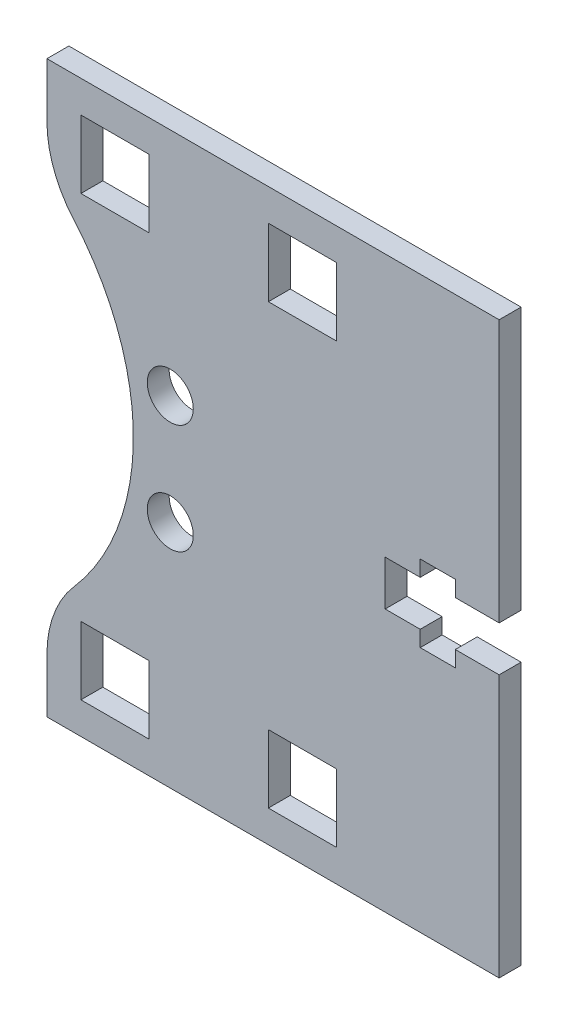
from build123d import *

# Parameters (mm, degrees)
SKETCH_1_R      = 2.1
SKETCH_1_W      = 6.2
SKETCH_1_H      = 6.2
EXTRUDE_1_DEPTH = 2
FILLET_1_R      = 10


with BuildPart() as part:
    # 草图1 → 凸台-拉伸1 (new body)
    with BuildSketch(Plane.XY):
        with BuildLine():
            Line((64.766222961, -26), (23.516222961, -26))
            Line((23.516222961, -26), (23.516222961, -16.9))
            ThreePointArc((23.516222961, -16.9), (31.401260639, 0), (23.516222961, 16.9))
            Line((23.516222961, 16.9), (23.516222961, 26))
            Line((23.516222961, 26), (64.766222961, 26))
            Line((64.766222961, 26), (64.766222961, 2.05))
            Line((64.766222961, 2.05), (60.766222961, 2.05))
            Line((60.766222961, 2.05), (60.766222961, 3.5))
            Line((60.766222961, 3.5), (57.566222961, 3.5))
            Line((57.566222961, 3.5), (57.566222961, 2.05))
            Line((57.566222961, 2.05), (54.366222961, 2.05))
            Line((54.366222961, 2.05), (54.366222961, -2.05))
            Line((54.366222961, -2.05), (57.566222961, -2.05))
            Line((57.566222961, -2.05), (57.566222961, -3.5))
            Line((57.566222961, -3.5), (60.766222961, -3.5))
            Line((60.766222961, -3.5), (60.766222961, -2.05))
            Line((60.766222961, -2.05), (64.766222961, -2.05))
            Line((64.766222961, -2.05), (64.766222961, -26))
        make_face()
        with Locations((34.766222961, 5)):
            Circle(SKETCH_1_R, mode=Mode.SUBTRACT)
        with Locations(Location((34.766222961, -5, 0), (0, 0, 180))):
            Circle(SKETCH_1_R, mode=Mode.SUBTRACT)
        with Locations((46.816222961, -20)):
            Rectangle(SKETCH_1_W, SKETCH_1_H, mode=Mode.SUBTRACT)
        with Locations((29.716222961, -20)):
            Rectangle(SKETCH_1_W, SKETCH_1_H, mode=Mode.SUBTRACT)
        with Locations((29.716222961, 20)):
            Rectangle(SKETCH_1_W, SKETCH_1_H, mode=Mode.SUBTRACT)
        with Locations((46.816222961, 20)):
            Rectangle(SKETCH_1_W, SKETCH_1_H, mode=Mode.SUBTRACT)
    extrude(amount=EXTRUDE_1_DEPTH)

    # 圆角1
    fillet_1_edges = [part.edges().sort_by_distance(p)[0] for p in [
        (23.516222961, -16.9, 1),
        (23.516222961, 16.9, 1),
    ]]
    fillet(fillet_1_edges, radius=FILLET_1_R)


solid = part.part
